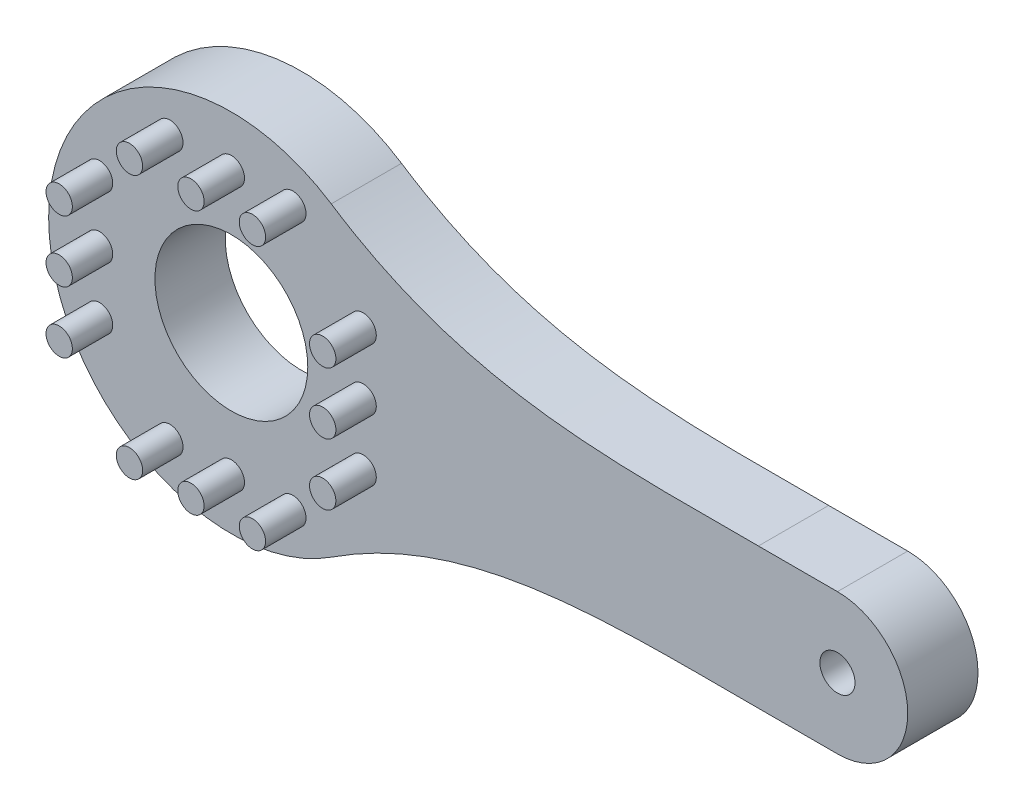
from build123d import *

# Parameters (mm, degrees)
SKETCH1_R           = 4.35
SKETCH1_R_2         = 1
BOSS_EXTRUDE1_DEPTH = 4
SKETCH2_R           = 0.75
BOSS_EXTRUDE2_DEPTH = 2.3


with BuildPart() as part:
    # Sketch1 → Boss-Extrude1 (new body)
    with BuildSketch(Plane.XY):
        with BuildLine():
            Line((30, 4), (34.5, 4))
            ThreePointArc((34.5, 4), (38.5, 0), (34.5, -4))
            Line((34.5, -4), (30, -4))
            add(Edge.make_bspline(
                [(5.686193022, -8.707882), (13.410427979, -3.664004406), (21.266865382, -4), (30, -4)],
                knots=[0, 0, 0, 0, 1, 1, 1, 1], degree=3))
            ThreePointArc((5.686193022, -8.707882), (-10.4, 0), (5.686193022, 8.707882))
            add(Edge.make_bspline(
                [(5.686193022, 8.707882), (13.410427979, 3.664004406), (21.266865382, 4), (30, 4)],
                knots=[0, 0, 0, 0, 1, 1, 1, 1], degree=3))
        make_face()
        Circle(SKETCH1_R, mode=Mode.SUBTRACT)
        with Locations((34.5, 0)):
            Circle(SKETCH1_R_2, mode=Mode.SUBTRACT)
    extrude(amount=BOSS_EXTRUDE1_DEPTH)

    # Sketch2 → Boss-Extrude2 (add)
    with BuildSketch(Plane.XY.offset(4)):
        with Locations(Location((0, 7.5, 0), (0, 0, 180))):
            Circle(SKETCH2_R)
        with Locations(Location((3.5, 7.5, 0), (0, 0, 180))):
            Circle(SKETCH2_R)
        with Locations(Location((-3.5, 7.5, 0), (0, 0, 180))):
            Circle(SKETCH2_R)
        with Locations(Location((3.5, -7.5, 0), (0, 0, 180))):
            Circle(SKETCH2_R)
        with Locations(Location((0, -7.5, 0), (0, 0, 180))):
            Circle(SKETCH2_R)
        with Locations(Location((-3.5, -7.5, 0), (0, 0, 180))):
            Circle(SKETCH2_R)
        with Locations(Location((7.5, 0, 0), (0, 0, 180))):
            Circle(SKETCH2_R)
        with Locations(Location((7.5, 3.5, 0), (0, 0, 180))):
            Circle(SKETCH2_R)
        with Locations(Location((7.5, -3.5, 0), (0, 0, 180))):
            Circle(SKETCH2_R)
        with Locations(Location((-7.5, -3.5, 0), (0, 0, 180))):
            Circle(SKETCH2_R)
        with Locations(Location((-7.5, 0, 0), (0, 0, 180))):
            Circle(SKETCH2_R)
        with Locations(Location((-7.5, 3.5, 0), (0, 0, 180))):
            Circle(SKETCH2_R)
    extrude(amount=BOSS_EXTRUDE2_DEPTH)


solid = part.part
